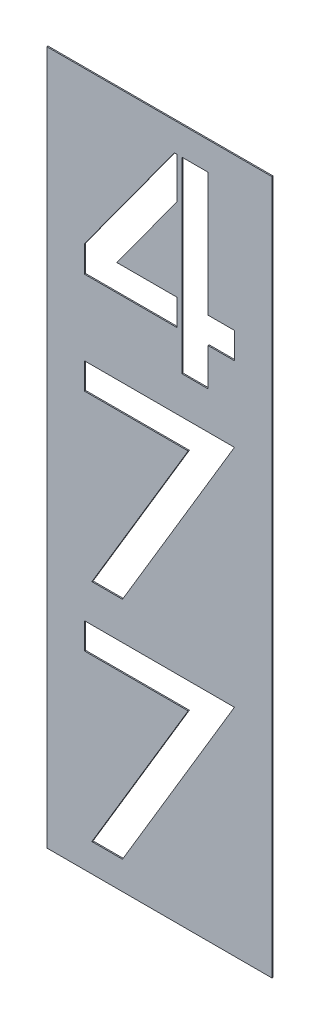
from build123d import *

# Parameters (mm, degrees)
BOSS_EXTRUDE1_DEPTH   = 0.4
SKETCH1_W             = 76.2
SKETCH1_H             = 234.95
BOSS_EXTRUDE1_2_DEPTH = 0.4
SKETCH2_W             = 1.5875
SKETCH2_H             = 50.8
BOSS_EXTRUDE2_DEPTH   = 0.4


with BuildPart() as part:
    # Sketch1 → Boss-Extrude1 (new body)
    with BuildSketch(Plane.XY):
        Polygon((7.62, 64.577865897), (-14.407538834, 34.29), (7.62, 34.29), align=None)
    extrude(amount=BOSS_EXTRUDE1_DEPTH)



with BuildPart() as body_2:
    # Sketch1 → Boss-Extrude1 2 (new body)
    with BuildSketch(Plane.XY):
        with Locations((0, -31.75)):
            Rectangle(SKETCH1_W, SKETCH1_H)
        Polygon((16.51, 76.2), (16.51, 34.29), (25.4, 34.29), (25.4, 25.4), (16.51, 25.4), (16.51, 12.7), (7.62, 12.7), (7.62, 25.4), (-25.4, 25.4), (-25.4, 34.29), (5.08, 76.2), align=None, mode=Mode.SUBTRACT)
        Polygon((-25.4, 0), (25.4, 0), (-12.506480557, -63.5), (-22.86, -63.5), (9.739573279, -8.89), (-25.4, -8.89), align=None, mode=Mode.SUBTRACT)
        Polygon((-25.4, -76.2), (25.4, -76.2), (-12.506480557, -139.7), (-22.86, -139.7), (9.739573279, -85.09), (-25.4, -85.09), align=None, mode=Mode.SUBTRACT)
    extrude(amount=BOSS_EXTRUDE1_2_DEPTH)


with BuildPart() as part_1:
    add(part.part)

    add(body_2.part)  # Boss-Extrude2 merges body 2
    # Sketch2 → Boss-Extrude2 (add)
    with BuildSketch(Plane.XY.offset(0.4)):
        with Locations((6.82625, 50.8)):
            Rectangle(SKETCH2_W, SKETCH2_H)
    extrude(amount=-BOSS_EXTRUDE2_DEPTH)


solid = part_1.part
